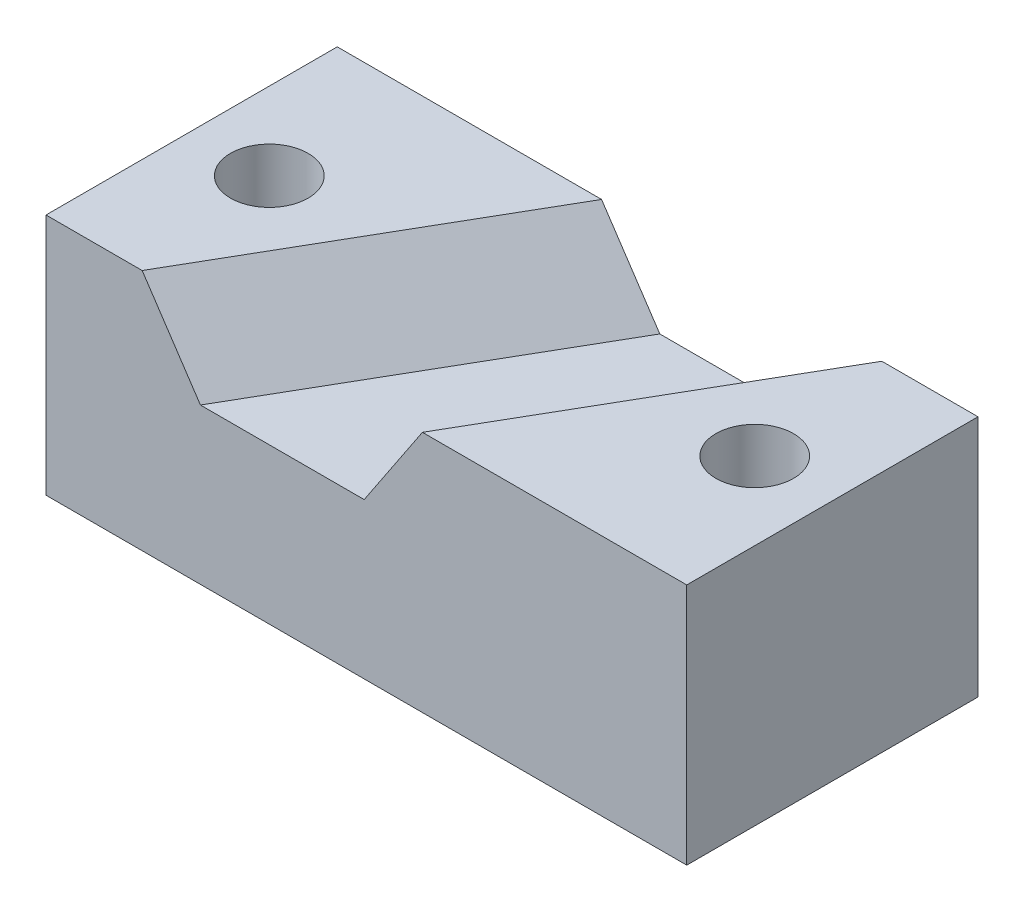
from build123d import *

# Parameters (mm, degrees)
SKETCH_1_W               = 132
SKETCH_1_H               = 60
EXTRUDE_1_DEPTH          = 50
CUT_EXTRUDE_1_DEPTH      = 154.37535656
CUT_EXTRUDE_1_DEPTH_BACK = 154.37535656
SKETCH_2_R               = 8
CUT_EXTRUDE_1_2_DEPTH    = 18
CUT_EXTRUDE_1_2_DRAFT    = -30


with BuildPart() as part:
    # 草图1 → 凸台-拉伸1 (new body)
    with BuildSketch(Plane(origin=(0, 0, 0), x_dir=(1, 0, 0), z_dir=(0, 1, 0))):
        with Locations((66, -30)):
            Rectangle(SKETCH_1_W, SKETCH_1_H)
    extrude(amount=EXTRUDE_1_DEPTH)

    # 草图2 → Cut-Extrude 1 (cut, two sides: drawn at the far end of the back side and taken through both)
    with BuildSketch(Plane(origin=(0, 50, 0), x_dir=(1, 0, 0), z_dir=(0, 1, 0)).offset(-CUT_EXTRUDE_1_DEPTH_BACK)):
        with Locations(Location((16, -30, 0), (0, 0, 270))):
            Circle(SKETCH_2_R)
        with Locations(Location((116, -30, 0), (0, 0, 270))):
            Circle(SKETCH_2_R)
    extrude(amount=CUT_EXTRUDE_1_DEPTH + CUT_EXTRUDE_1_DEPTH_BACK, mode=Mode.SUBTRACT)


with BuildPart() as cut_extrude_1_2_tool:
    # 草图4 → Cut-Extrude 1 2 (with draft: the straight prism first)
    with BuildSketch(Plane(origin=(0, 50, 0), x_dir=(1, 0, 0), z_dir=(0, 1, 0))):
        Polygon((76.145931536, 37.57326891), (9.744604929, -77.437202462), (53.045875119, -102.437202462), (119.447201725, 12.57326891), align=None)
    extrude(amount=-CUT_EXTRUDE_1_2_DEPTH)
    # Cut-Extrude 1 2: the draft: its side faces are tilted about the plane it starts from
    cut_extrude_1_2_sides = [cut_extrude_1_2_tool.faces().sort_by_distance(p)[0] for p in [
        (42.945268233, 41, 19.931966776),
        (31.395240024, 41, 89.937202462),
        (86.246538422, 41, 44.931966776),
        (97.79656663, 41, -25.07326891),
    ]]
    draft(cut_extrude_1_2_sides, Plane(origin=(0, 50, 0), x_dir=(1, 0, 0), z_dir=(0, 1, 0)), CUT_EXTRUDE_1_2_DRAFT)


with BuildPart() as part_1:
    add(part.part)

    # Cut-Extrude 1 2: cut by cut_extrude_1_2_tool
    add(cut_extrude_1_2_tool.part, mode=Mode.SUBTRACT)


solid = part_1.part
